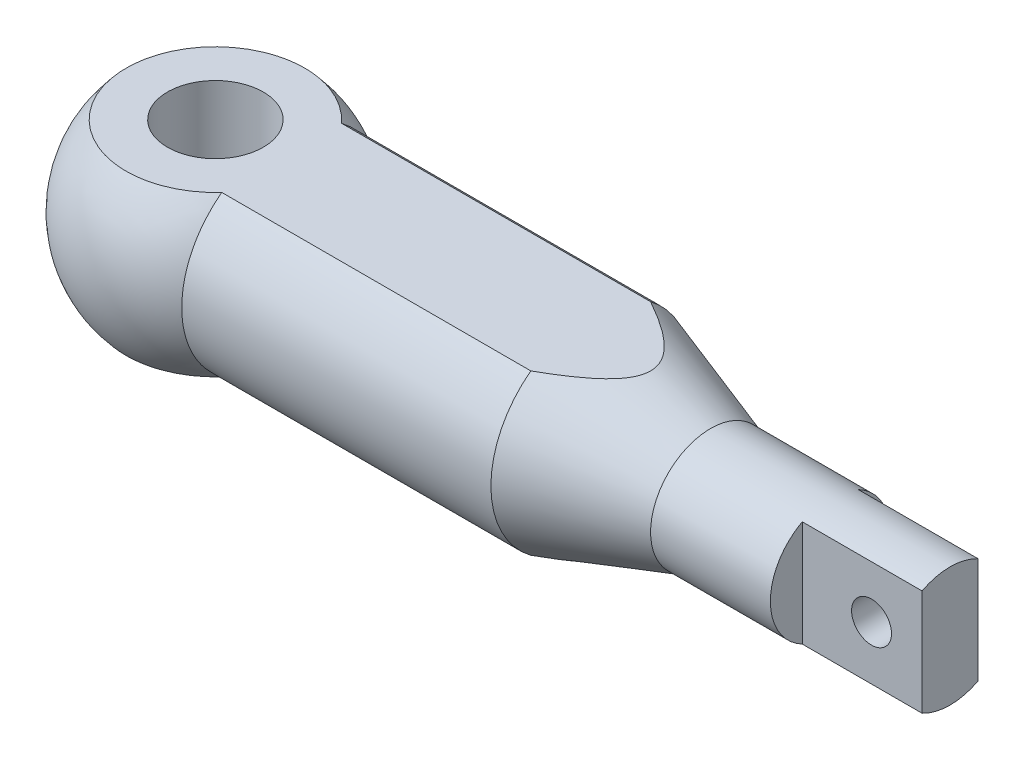
from build123d import *
from OCP.BRepAlgoAPI import BRepAlgoAPI_Cut
from OCP.TopTools import TopTools_ListOfShape

# Parameters (mm, degrees)
SKETCH24_W          = 47
SKETCH24_H          = 12.5
BOSS_EXTRUDE8_DEPTH = 15
BOSS_EXTRUDE9_DEPTH = 30
CUT_EXTRUDE11_DEPTH = 129
SKETCH28_R          = 6
CUT_EXTRUDE12_DEPTH = 129
SKETCH29_R          = 2.5
CUT_EXTRUDE13_DEPTH = 129


with BuildPart() as part:
    # Sketch23 → Revolve5 (revolve)
    with BuildSketch(Plane(origin=(0, 0, 0), x_dir=(1, 0, 0), z_dir=(0, 1, 0))):
        with BuildLine():
            Line((-139.62446819, 21.638655814), (-139.62446819, -8.361344186))
            ThreePointArc((-139.62446819, -8.361344186), (-154.62446819, 6.638655814), (-139.62446819, 21.638655814))
        make_face()
    revolve(axis=Axis((-139.62446819, 0, -21.638655814), (0, 0, 1)))

    # Sketch24 → Revolve6 (revolve)
    with BuildSketch(Plane(origin=(0, 0, 0), x_dir=(1, 0, 0), z_dir=(0, 1, 0))):
        with Locations((-116.12446819, 0.388655814)):
            Rectangle(SKETCH24_W, SKETCH24_H)
    revolve(axis=Axis((-92.62446819, 0, -6.638655814), (-1, 0, 0)))

    # Sketch25 → Revolve7 (revolve)
    with BuildSketch(Plane(origin=(0, 0, 0), x_dir=(1, 0, 0), z_dir=(0, 1, 0))):
        Polygon((-92.62446819, -5.861344186), (-92.62446819, 6.638655814), (-77.62446819, 6.638655814), (-77.62446819, -0.861344186), align=None)
    revolve(axis=Axis((-77.62446819, 0, -6.638655814), (-1, 0, 0)))

    # Sketch26 → Boss-Extrude8 (add)
    with BuildSketch(Plane(origin=(-77.62446819, 0, 0), x_dir=(0, 0, -1), z_dir=(1, 0, 0))):
        with BuildLine():
            Line((3.138655814, -6.633249581), (3.138655814, 6.633249581))
            ThreePointArc((3.138655814, 6.633249581), (-0.861344186, 0), (3.138655814, -6.633249581))
        make_face()
        with BuildLine():
            ThreePointArc((10.138655814, -6.633249581), (14.138655814, 0), (10.138655814, 6.633249581))
            Line((10.138655814, 6.633249581), (10.138655814, -6.633249581))
        make_face()
    extrude(amount=BOSS_EXTRUDE8_DEPTH)

    # Sketch26<3> → Boss-Extrude9 (add)
    with BuildSketch(Plane(origin=(-77.62446819, 0, 0), x_dir=(0, 0, -1), z_dir=(1, 0, 0))):
        with BuildLine():
            ThreePointArc((10.138655814, 6.633249581), (6.638655814, 7.5), (3.138655814, 6.633249581))
            Line((3.138655814, 6.633249581), (3.138655814, -6.633249581))
            ThreePointArc((3.138655814, -6.633249581), (6.638655814, -7.5), (10.138655814, -6.633249581))
            Line((10.138655814, -6.633249581), (10.138655814, 6.633249581))
        make_face()
    extrude(amount=BOSS_EXTRUDE9_DEPTH)


with BuildPart() as cut_extrude11_tool:
    # Sketch27 → Cut-Extrude11 (new body)
    with BuildSketch(Plane(origin=(-47.62446819, 0, 0), x_dir=(0, 0, -1), z_dir=(1, 0, 0))):
        Polygon((6.638655814, 10), (21.638655814, 10), (21.638655814, 15), (-8.361344186, 15), (-8.361344186, 10), align=None)
        Polygon((6.638655814, -10), (21.638655814, -10), (21.638655814, -15), (-8.361344186, -15), (-8.361344186, -10), align=None)
    extrude(amount=-CUT_EXTRUDE11_DEPTH)


with BuildPart() as part_1:
    add(part.part)

    # Cut-Extrude11: cut by cut_extrude11_tool, with a tolerance
    cut_extrude11_stock = TopTools_ListOfShape()
    cut_extrude11_stock.Append(part_1.part.wrapped)
    cut_extrude11_tools = TopTools_ListOfShape()
    cut_extrude11_tools.Append(cut_extrude11_tool.part.wrapped)
    cut_extrude11_cut = BRepAlgoAPI_Cut()
    cut_extrude11_cut.SetArguments(cut_extrude11_stock)
    cut_extrude11_cut.SetTools(cut_extrude11_tools)
    cut_extrude11_cut.SetFuzzyValue(0.00001)
    cut_extrude11_cut.Build()
    add(Compound.cast(cut_extrude11_cut.Shape()).solids(), mode=Mode.REPLACE)

    # Sketch28 → Cut-Extrude12 (cut)
    with BuildSketch(Plane(origin=(0, 10, 0), x_dir=(1, 0, 0), z_dir=(0, 1, 0))):
        with Locations((-139.62446819, 6.638655814)):
            Circle(SKETCH28_R)
    extrude(amount=-CUT_EXTRUDE12_DEPTH, mode=Mode.SUBTRACT)

    # Sketch29 → Cut-Extrude13 (cut)
    with BuildSketch(Plane.XY.offset(-3.138655814)):
        with Locations((-53.95726021, 0.09)):
            Circle(SKETCH29_R)
    extrude(amount=-CUT_EXTRUDE13_DEPTH, mode=Mode.SUBTRACT)


solid = part_1.part
